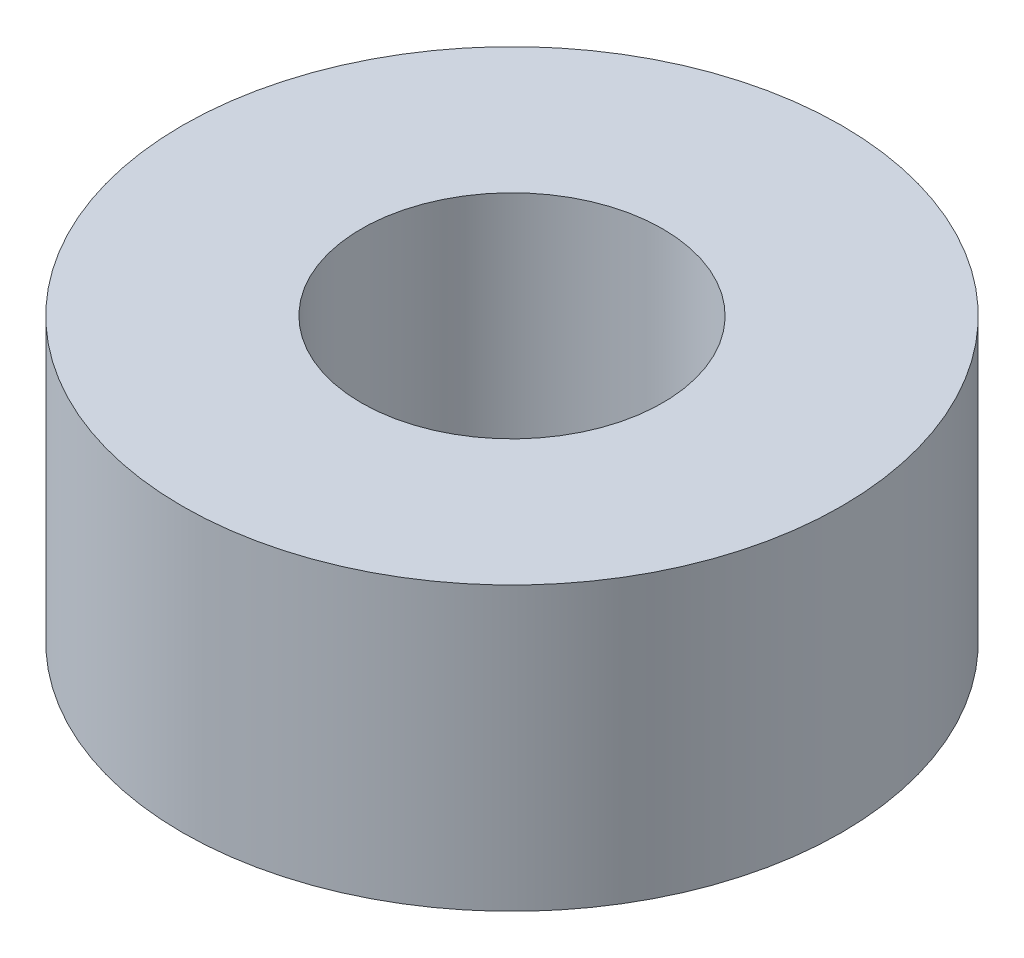
from build123d import *

# Parameters (mm, degrees)
CROQUIS1_R              = 3.5
CROQUIS1_R_2            = 1.6
SALIENTE_EXTRUIR1_DEPTH = 3


with BuildPart() as part:
    # Croquis1 → Saliente-Extruir1 (new body)
    with BuildSketch(Plane(origin=(0, 0, 0), x_dir=(1, 0, 0), z_dir=(0, 1, 0))):
        with Locations(Location((0, 0, 0), (0, 0, 270))):
            Circle(CROQUIS1_R)
        with Locations(Location((0, 0, 0), (0, 0, 270))):
            Circle(CROQUIS1_R_2, mode=Mode.SUBTRACT)
    extrude(amount=SALIENTE_EXTRUIR1_DEPTH)


solid = part.part
